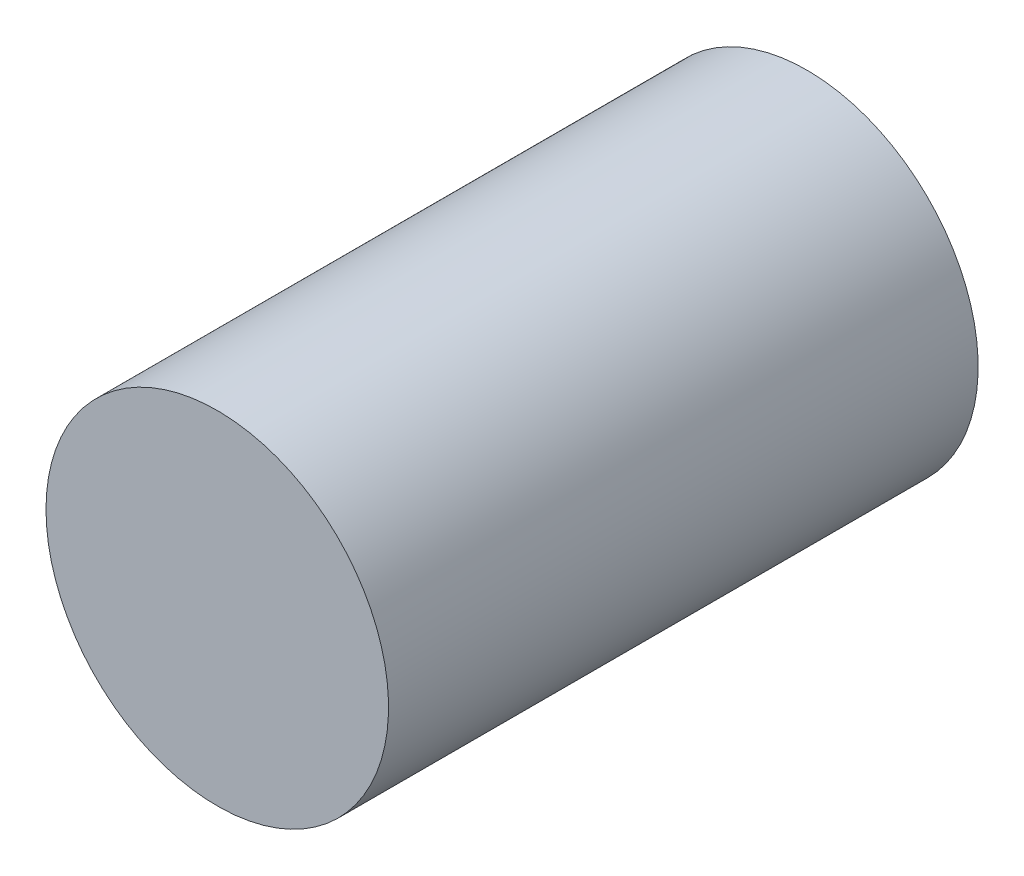
from build123d import *

# Parameters (mm, degrees)
SKETCH1_R      = 6.1
ENVELOPE_DEPTH = 21


with BuildPart() as part:
    # Sketch1 → Envelope (new body)
    with BuildSketch(Plane.XY):
        with Locations(Location((0, 0, 0), (0, 0, 180))):
            Circle(SKETCH1_R)
    extrude(amount=ENVELOPE_DEPTH)


solid = part.part
